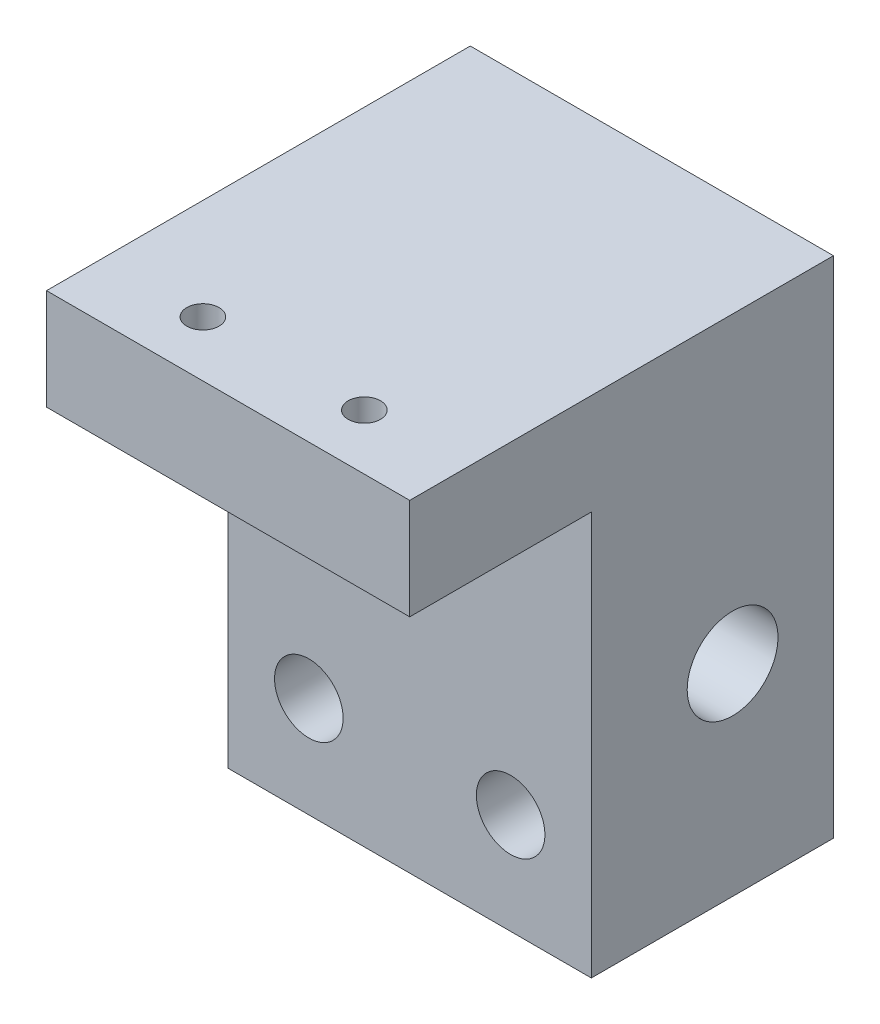
from build123d import *

# Parameters (mm, degrees)
SKETCH_1_W          = 36
SKETCH_1_H          = 24
EXTRUDE_1_DEPTH     = 50
SKETCH_2_R          = 4.5
CUT_EXTRUDE_1_DEPTH = 36
SKETCH_3_R          = 3.4
CUT_EXTRUDE_2_DEPTH = 6
SKETCH_5_W          = 18
SKETCH_5_H          = 10
EXTRUDE_2_DEPTH     = 36
SKETCH_6_R          = 1.6
CUT_EXTRUDE_3_DEPTH = 5


with BuildPart() as part:
    # 草图1 → 凸台-拉伸1 (new body)
    with BuildSketch(Plane(origin=(0, 0, 0), x_dir=(1, 0, 0), z_dir=(0, 1, 0))):
        with Locations((18, 12)):
            Rectangle(SKETCH_1_W, SKETCH_1_H)
    extrude(amount=EXTRUDE_1_DEPTH)

    # 草图2 → 切除-拉伸1 (cut)
    with BuildSketch(Plane.ZY):
        with Locations((-14, 20)):
            Circle(SKETCH_2_R)
    extrude(amount=-CUT_EXTRUDE_1_DEPTH, mode=Mode.SUBTRACT)

    # 草图3 → 切除-拉伸2 (cut)
    with BuildSketch(Plane.XY):
        with Locations((8, 10)):
            Circle(SKETCH_3_R)
        with Locations((28, 10)):
            Circle(SKETCH_3_R)
    extrude(amount=-CUT_EXTRUDE_2_DEPTH, mode=Mode.SUBTRACT)

    # 草图5 → 凸台-拉伸2 (add)
    with BuildSketch(Plane(origin=(36, 0, 0), x_dir=(0, 0, -1), z_dir=(1, 0, 0))):
        with Locations((-9, 45)):
            Rectangle(SKETCH_5_W, SKETCH_5_H)
    extrude(amount=-EXTRUDE_2_DEPTH)

    # 草图6 → 切除-拉伸3 (cut)
    with BuildSketch(Plane(origin=(0, 50, 0), x_dir=(1, 0, 0), z_dir=(0, 1, 0))):
        with Locations(Location((26, -12.5, 0), (0, 0, 270))):
            Circle(SKETCH_6_R)
        with Locations(Location((10, -12.5, 0), (0, 0, 270))):
            Circle(SKETCH_6_R)
    extrude(amount=-CUT_EXTRUDE_3_DEPTH, mode=Mode.SUBTRACT)


solid = part.part
